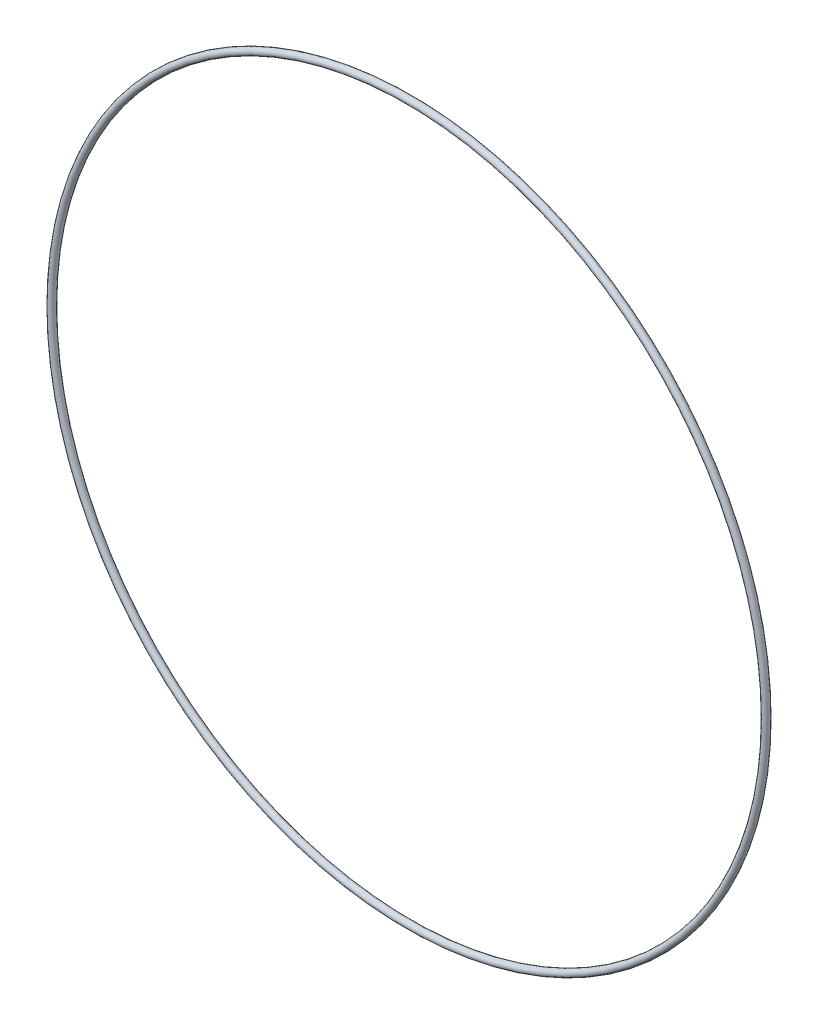
from build123d import *

# Parameters (mm, degrees)
SKETCH2_R = 1.5


with BuildPart() as part:
    # Sweep1: sweep along a path in Sketch1
    with BuildLine(Plane.XY) as sweep1_path:
        CenterArc((0, 0), 154, 0, 360)
    # Sketch2 → Sweep1 (sweep)
    with BuildSketch(Plane(origin=(0, 0, 0), x_dir=(1, 0, 0), z_dir=(0, 1, 0))):
        with Locations((154, 0)):
            Circle(SKETCH2_R)
    sweep(path=sweep1_path.line)


solid = part.part
